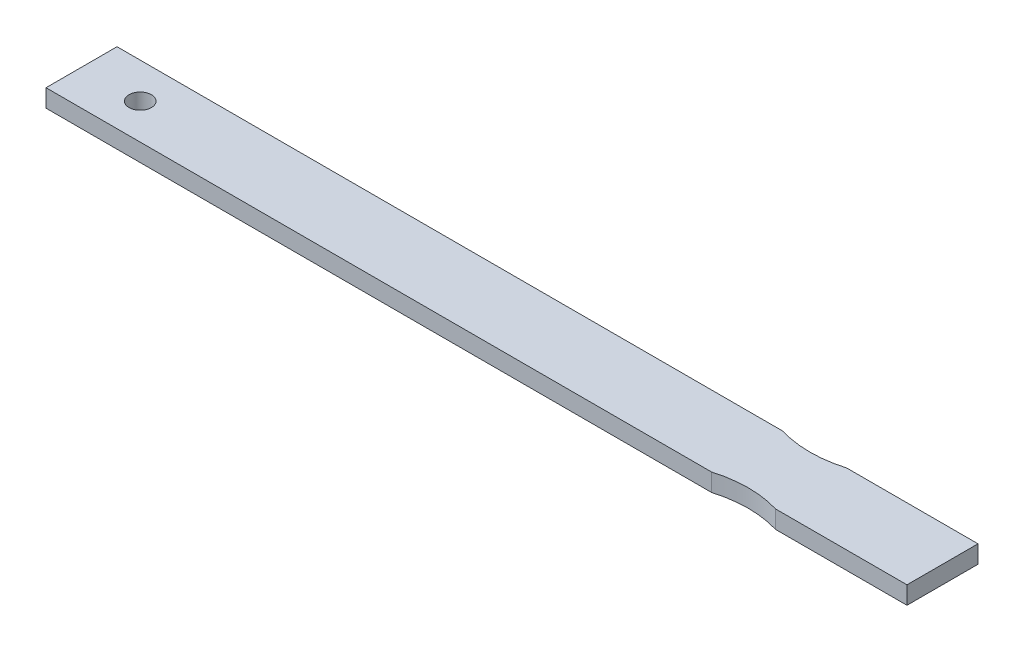
from build123d import *

# Parameters (mm, degrees)
SKETCH1_R           = 4
BOSS_EXTRUDE1_DEPTH = 6.35


with BuildPart() as part:
    # Sketch1 → Boss-Extrude1 (new body)
    with BuildSketch(Plane(origin=(0, 0, 0), x_dir=(1, 0, 0), z_dir=(0, 1, 0))):
        with BuildLine():
            Line((84.1, -12.7), (-153.95, -12.7))
            Line((-153.95, -12.7), (-153.95, 12.7))
            Line((-153.95, 12.7), (84.1, 12.7))
            ThreePointArc((84.1, 12.7), (95.53, 11.032167953), (106.96, 12.7))
            Line((106.96, 12.7), (153.95, 12.7))
            Line((153.95, 12.7), (153.95, -12.7))
            Line((153.95, -12.7), (106.96, -12.7))
            ThreePointArc((106.96, -12.7), (95.53, -11.032167953), (84.1, -12.7))
        make_face()
        with Locations(Location((-132.95, 0, 0), (0, 0, 270))):
            Circle(SKETCH1_R, mode=Mode.SUBTRACT)
    extrude(amount=BOSS_EXTRUDE1_DEPTH)


solid = part.part
